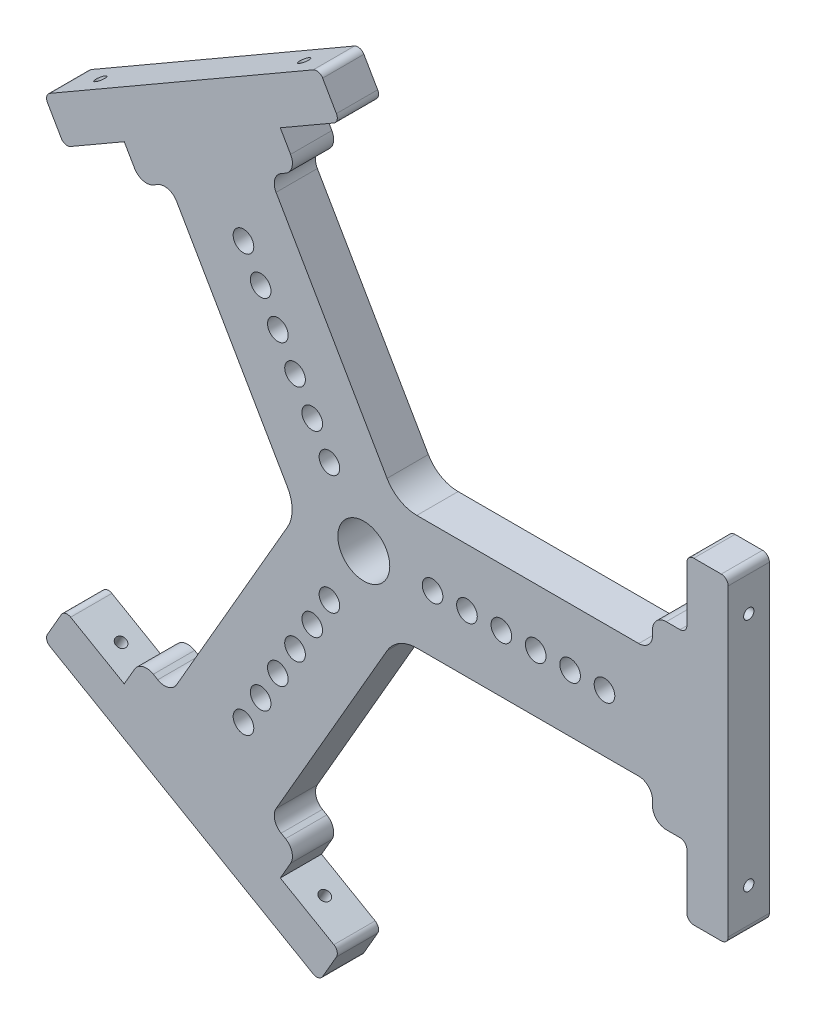
from build123d import *

# Parameters (mm, degrees)
ESQUISSE1_R                  = 3
ESQUISSE1_R_2                = 7.55
BOSS_EXTRU_1_DEPTH           = 6
ESQUISSE2_R                  = 1.5
ENL_V_MAT_EXTRU_1_DEPTH      = 219.511470169
R_P_TITION_CIRCULAIRE1_COUNT = 3


with BuildPart() as part:
    # Esquisse1 → Boss.-Extru.1 (new, symmetric)
    with BuildSketch(Plane.XY):
        with BuildLine():
            Line((93.969262079, 44.202014333), (93.969262079, 28.202014333))
            ThreePointArc((93.969262079, 28.202014333), (93.383475641, 26.78780077), (91.969262079, 26.202014333))
            Line((91.969262079, 26.202014333), (87.969262079, 26.202014333))
            ThreePointArc((87.969262079, 26.202014333), (85.140834954, 25.030441457), (83.969262079, 22.202014333))
            Line((83.969262079, 22.202014333), (83.969262079, 20.710100717))
            ThreePointArc((83.969262079, 20.710100717), (82.797689203, 17.881673592), (79.969262079, 16.710100717))
            Line((79.969262079, 16.710100717), (15.421083839, 16.710100717))
            ThreePointArc((15.421083839, 16.710100717), (10.421083839, 18.049846679), (6.760829801, 21.710100717))
            Line((6.760829801, 21.710100717), (-25.513259319, 77.61046284))
            ThreePointArc((-25.513259319, 77.61046284), (-25.912861009, 80.645739021), (-24.049157704, 83.074564455))
            Line((-24.049157704, 83.074564455), (-22.757122612, 83.820521263))
            ThreePointArc((-22.757122612, 83.820521263), (-20.893419307, 86.249346698), (-21.293020997, 89.284622879))
            Line((-21.293020997, 89.284622879), (-24.293020997, 94.480775301))
            Line((-24.293020997, 94.480775301), (-8.704563729, 103.480775301))
            ThreePointArc((-8.704563729, 103.480775301), (-7.772712076, 104.695188019), (-7.972512921, 106.212826109))
            Line((-7.972512921, 106.212826109), (-11.972512921, 113.141029339))
            ThreePointArc((-11.972512921, 113.141029339), (-13.186925639, 114.072880992), (-14.704563729, 113.873080147))
            Line((-14.704563729, 113.873080147), (-91.26469835, 69.671065814))
            ThreePointArc((-91.26469835, 69.671065814), (-92.196550002, 68.456653097), (-91.996749157, 66.939015006))
            Line((-91.996749157, 66.939015006), (-87.996749157, 60.010811776))
            ThreePointArc((-87.996749157, 60.010811776), (-86.78233644, 59.078960124), (-85.26469835, 59.278760969))
            Line((-85.26469835, 59.278760969), (-69.676241082, 68.278760969))
            Line((-69.676241082, 68.278760969), (-66.676241082, 63.082608546))
            ThreePointArc((-66.676241082, 63.082608546), (-64.247415647, 61.218905241), (-61.212139466, 61.618506931))
            Line((-61.212139466, 61.618506931), (-59.920104375, 62.364463739))
            ThreePointArc((-59.920104375, 62.364463739), (-56.884828194, 62.764065429), (-54.45600276, 60.900362124))
            Line((-54.45600276, 60.900362124), (-22.18191364, 5))
            ThreePointArc((-22.18191364, 5), (-20.842167678, 0), (-22.18191364, -5))
            Line((-22.18191364, -5), (-54.45600276, -60.900362124))
            ThreePointArc((-54.45600276, -60.900362124), (-56.884828194, -62.764065429), (-59.920104375, -62.364463739))
            Line((-59.920104375, -62.364463739), (-61.212139466, -61.618506931))
            ThreePointArc((-61.212139466, -61.618506931), (-64.247415647, -61.218905241), (-66.676241082, -63.082608546))
            Line((-66.676241082, -63.082608546), (-69.676241082, -68.278760969))
            Line((-69.676241082, -68.278760969), (-85.26469835, -59.278760969))
            ThreePointArc((-85.26469835, -59.278760969), (-86.78233644, -59.078960124), (-87.996749157, -60.010811776))
            Line((-87.996749157, -60.010811776), (-91.996749157, -66.939015007))
            ThreePointArc((-91.996749157, -66.939015007), (-92.196550002, -68.456653097), (-91.26469835, -69.671065814))
            Line((-91.26469835, -69.671065814), (-14.704563729, -113.873080147))
            ThreePointArc((-14.704563729, -113.873080147), (-13.186925639, -114.072880992), (-11.972512921, -113.141029339))
            Line((-11.972512921, -113.141029339), (-7.972512921, -106.212826109))
            ThreePointArc((-7.972512921, -106.212826109), (-7.772712076, -104.695188019), (-8.704563729, -103.480775301))
            Line((-8.704563729, -103.480775301), (-24.293020997, -94.480775301))
            Line((-24.293020997, -94.480775301), (-21.293020997, -89.284622879))
            ThreePointArc((-21.293020997, -89.284622879), (-20.893419307, -86.249346698), (-22.757122612, -83.820521263))
            Line((-22.757122612, -83.820521263), (-24.049157704, -83.074564455))
            ThreePointArc((-24.049157704, -83.074564455), (-25.912861009, -80.645739021), (-25.513259319, -77.61046284))
            Line((-25.513259319, -77.61046284), (6.760829801, -21.710100717))
            ThreePointArc((6.760829801, -21.710100717), (10.421083839, -18.049846679), (15.421083839, -16.710100717))
            Line((15.421083839, -16.710100717), (79.969262079, -16.710100717))
            ThreePointArc((79.969262079, -16.710100717), (82.797689203, -17.881673592), (83.969262079, -20.710100717))
            Line((83.969262079, -20.710100717), (83.969262079, -22.202014333))
            ThreePointArc((83.969262079, -22.202014333), (85.140834954, -25.030441457), (87.969262079, -26.202014333))
            Line((87.969262079, -26.202014333), (91.969262079, -26.202014333))
            ThreePointArc((91.969262079, -26.202014333), (93.383475641, -26.78780077), (93.969262079, -28.202014333))
            Line((93.969262079, -28.202014333), (93.969262079, -44.202014333))
            ThreePointArc((93.969262079, -44.202014333), (94.555048516, -45.616227895), (95.969262079, -46.202014333))
            Line((95.969262079, -46.202014333), (103.969262079, -46.202014333))
            ThreePointArc((103.969262079, -46.202014333), (105.383475641, -45.616227895), (105.969262079, -44.202014333))
            Line((105.969262079, -44.202014333), (105.969262079, 44.202014333))
            ThreePointArc((105.969262079, 44.202014333), (105.383475641, 45.616227895), (103.969262079, 46.202014333))
            Line((103.969262079, 46.202014333), (95.969262079, 46.202014333))
            ThreePointArc((95.969262079, 46.202014333), (94.555048516, 45.616227895), (93.969262079, 44.202014333))
        make_face()
        with Locations((-35, -60.621778265)):
            Circle(ESQUISSE1_R, mode=Mode.SUBTRACT)
        with Locations((-30, -51.961524227)):
            Circle(ESQUISSE1_R, mode=Mode.SUBTRACT)
        with Locations((-25, -43.301270189)):
            Circle(ESQUISSE1_R, mode=Mode.SUBTRACT)
        with Locations((-20, -34.641016151)):
            Circle(ESQUISSE1_R, mode=Mode.SUBTRACT)
        with Locations((-15, -25.980762114)):
            Circle(ESQUISSE1_R, mode=Mode.SUBTRACT)
        with Locations((-10, -17.320508076)):
            Circle(ESQUISSE1_R, mode=Mode.SUBTRACT)
        with Locations((-10, 17.320508076)):
            Circle(ESQUISSE1_R, mode=Mode.SUBTRACT)
        with Locations((-15, 25.980762114)):
            Circle(ESQUISSE1_R, mode=Mode.SUBTRACT)
        with Locations((-20, 34.641016151)):
            Circle(ESQUISSE1_R, mode=Mode.SUBTRACT)
        with Locations((-25, 43.301270189)):
            Circle(ESQUISSE1_R, mode=Mode.SUBTRACT)
        with Locations((-30, 51.961524227)):
            Circle(ESQUISSE1_R, mode=Mode.SUBTRACT)
        with Locations((-35, 60.621778265)):
            Circle(ESQUISSE1_R, mode=Mode.SUBTRACT)
        with Locations((20, 0)):
            Circle(ESQUISSE1_R, mode=Mode.SUBTRACT)
        with Locations((30, 0)):
            Circle(ESQUISSE1_R, mode=Mode.SUBTRACT)
        with Locations((40, 0)):
            Circle(ESQUISSE1_R, mode=Mode.SUBTRACT)
        with Locations((50, 0)):
            Circle(ESQUISSE1_R, mode=Mode.SUBTRACT)
        with Locations((60, 0)):
            Circle(ESQUISSE1_R, mode=Mode.SUBTRACT)
        with Locations((70, 0)):
            Circle(ESQUISSE1_R, mode=Mode.SUBTRACT)
        Circle(ESQUISSE1_R_2, mode=Mode.SUBTRACT)
    extrude(amount=BOSS_EXTRU_1_DEPTH, both=True)

    # Esquisse2 → Enlèv. mat.-Extru.1 (cut, through all)
    with BuildSketch(Plane.ZY.offset(-93.969262079)):
        with Locations((0, 34.202014333)):
            Circle(ESQUISSE2_R)
        with Locations((0, -34.202014333)):
            Circle(ESQUISSE2_R)
    enl_v_mat_extru_1 = extrude(amount=-ENL_V_MAT_EXTRU_1_DEPTH, mode=Mode.SUBTRACT)

    # Répétition circulaire1: Enlèv. mat.-Extru.1 ×3 about axis
    r_p_tition_circulaire1_axis = Axis((0, 0, 6), (0, 0, -1))
    for i in range(1, R_P_TITION_CIRCULAIRE1_COUNT):
        add(enl_v_mat_extru_1.rotate(r_p_tition_circulaire1_axis, i * 360 / R_P_TITION_CIRCULAIRE1_COUNT), mode=Mode.SUBTRACT)


solid = part.part
